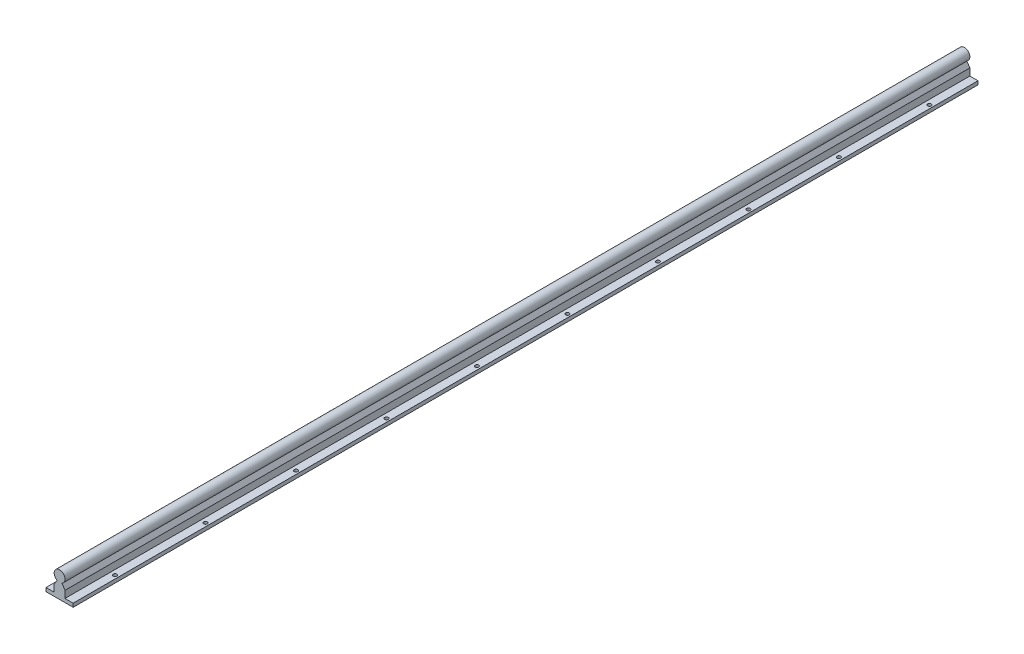
from build123d import *

# Parameters (mm, degrees)
BOSS_EXTRUDE1_DEPTH = 1000
CUT_EXTRUDE1_REACH  = 1002.492
SKETCH2_R           = 2


with BuildPart() as part:
    # Sketch1 → Boss-Extrude1 (new body)
    with BuildSketch(Plane.XY):
        with BuildLine():
            Line((19.707457755, 0), (-10.292542245, 0))
            Line((-10.292542245, 0), (-10.292542245, 4))
            Line((-10.292542245, 4), (-1.292542245, 4))
            Line((-1.292542245, 4), (-1.292542245, 11.8))
            Line((-1.292542245, 11.8), (2.107457755, 17))
            ThreePointArc((2.107457755, 17), (4.707457755, 28.407402334), (7.307457755, 17))
            Line((7.307457755, 17), (10.707457755, 11.8))
            Line((10.707457755, 11.8), (10.707457755, 4))
            Line((10.707457755, 4), (19.707457755, 4))
            Line((19.707457755, 4), (19.707457755, 0))
        make_face()
    extrude(amount=BOSS_EXTRUDE1_DEPTH)

    # Sketch2 → Cut-Extrude1 (cut, up to next)
    with BuildSketch(Plane(origin=(0, 4, 0), x_dir=(1, 0, 0), z_dir=(0, 1, 0)), mode=Mode.PRIVATE) as cut_extrude1_sk1:
        with Locations(Location((-6.542542245, -50, 0), (0, 0, 180))):
            Circle(SKETCH2_R)
    cut_extrude1_tool1 = extrude(cut_extrude1_sk1.sketch, amount=-CUT_EXTRUDE1_REACH, mode=Mode.PRIVATE) & part.part
    # Sketch2 → Cut-Extrude1 (cut, up to next)
    with BuildSketch(Plane(origin=(0, 4, 0), x_dir=(1, 0, 0), z_dir=(0, 1, 0)), mode=Mode.PRIVATE) as cut_extrude1_sk2:
        with Locations(Location((-6.542542245, -150, 0), (0, 0, 180))):
            Circle(SKETCH2_R)
    cut_extrude1_tool2 = extrude(cut_extrude1_sk2.sketch, amount=-CUT_EXTRUDE1_REACH, mode=Mode.PRIVATE) & part.part
    # Sketch2 → Cut-Extrude1 (cut, up to next)
    with BuildSketch(Plane(origin=(0, 4, 0), x_dir=(1, 0, 0), z_dir=(0, 1, 0)), mode=Mode.PRIVATE) as cut_extrude1_sk3:
        with Locations(Location((-6.542542245, -250, 0), (0, 0, 180))):
            Circle(SKETCH2_R)
    cut_extrude1_tool3 = extrude(cut_extrude1_sk3.sketch, amount=-CUT_EXTRUDE1_REACH, mode=Mode.PRIVATE) & part.part
    # Sketch2 → Cut-Extrude1 (cut, up to next)
    with BuildSketch(Plane(origin=(0, 4, 0), x_dir=(1, 0, 0), z_dir=(0, 1, 0)), mode=Mode.PRIVATE) as cut_extrude1_sk4:
        with Locations(Location((-6.542542245, -350, 0), (0, 0, 180))):
            Circle(SKETCH2_R)
    cut_extrude1_tool4 = extrude(cut_extrude1_sk4.sketch, amount=-CUT_EXTRUDE1_REACH, mode=Mode.PRIVATE) & part.part
    # Sketch2 → Cut-Extrude1 (cut, up to next)
    with BuildSketch(Plane(origin=(0, 4, 0), x_dir=(1, 0, 0), z_dir=(0, 1, 0)), mode=Mode.PRIVATE) as cut_extrude1_sk5:
        with Locations(Location((-6.542542245, -450, 0), (0, 0, 180))):
            Circle(SKETCH2_R)
    cut_extrude1_tool5 = extrude(cut_extrude1_sk5.sketch, amount=-CUT_EXTRUDE1_REACH, mode=Mode.PRIVATE) & part.part
    # Sketch2 → Cut-Extrude1 (cut, up to next)
    with BuildSketch(Plane(origin=(0, 4, 0), x_dir=(1, 0, 0), z_dir=(0, 1, 0)), mode=Mode.PRIVATE) as cut_extrude1_sk6:
        with Locations(Location((-6.542542245, -550, 0), (0, 0, 180))):
            Circle(SKETCH2_R)
    cut_extrude1_tool6 = extrude(cut_extrude1_sk6.sketch, amount=-CUT_EXTRUDE1_REACH, mode=Mode.PRIVATE) & part.part
    # Sketch2 → Cut-Extrude1 (cut, up to next)
    with BuildSketch(Plane(origin=(0, 4, 0), x_dir=(1, 0, 0), z_dir=(0, 1, 0)), mode=Mode.PRIVATE) as cut_extrude1_sk7:
        with Locations(Location((-6.542542245, -650, 0), (0, 0, 180))):
            Circle(SKETCH2_R)
    cut_extrude1_tool7 = extrude(cut_extrude1_sk7.sketch, amount=-CUT_EXTRUDE1_REACH, mode=Mode.PRIVATE) & part.part
    # Sketch2 → Cut-Extrude1 (cut, up to next)
    with BuildSketch(Plane(origin=(0, 4, 0), x_dir=(1, 0, 0), z_dir=(0, 1, 0)), mode=Mode.PRIVATE) as cut_extrude1_sk8:
        with Locations(Location((-6.542542245, -750, 0), (0, 0, 180))):
            Circle(SKETCH2_R)
    cut_extrude1_tool8 = extrude(cut_extrude1_sk8.sketch, amount=-CUT_EXTRUDE1_REACH, mode=Mode.PRIVATE) & part.part
    # Sketch2 → Cut-Extrude1 (cut, up to next)
    with BuildSketch(Plane(origin=(0, 4, 0), x_dir=(1, 0, 0), z_dir=(0, 1, 0)), mode=Mode.PRIVATE) as cut_extrude1_sk9:
        with Locations(Location((-6.542542245, -850, 0), (0, 0, 180))):
            Circle(SKETCH2_R)
    cut_extrude1_tool9 = extrude(cut_extrude1_sk9.sketch, amount=-CUT_EXTRUDE1_REACH, mode=Mode.PRIVATE) & part.part
    # Sketch2 → Cut-Extrude1 (cut, up to next)
    with BuildSketch(Plane(origin=(0, 4, 0), x_dir=(1, 0, 0), z_dir=(0, 1, 0)), mode=Mode.PRIVATE) as cut_extrude1_sk10:
        with Locations(Location((-6.542542245, -950, 0), (0, 0, 180))):
            Circle(SKETCH2_R)
    cut_extrude1_tool10 = extrude(cut_extrude1_sk10.sketch, amount=-CUT_EXTRUDE1_REACH, mode=Mode.PRIVATE) & part.part
    # Sketch2 → Cut-Extrude1 (cut, up to next)
    with BuildSketch(Plane(origin=(0, 4, 0), x_dir=(1, 0, 0), z_dir=(0, 1, 0)), mode=Mode.PRIVATE) as cut_extrude1_sk11:
        with Locations(Location((15.957457755, -50, 0), (0, 0, 180))):
            Circle(SKETCH2_R)
    cut_extrude1_tool11 = extrude(cut_extrude1_sk11.sketch, amount=-CUT_EXTRUDE1_REACH, mode=Mode.PRIVATE) & part.part
    # Sketch2 → Cut-Extrude1 (cut, up to next)
    with BuildSketch(Plane(origin=(0, 4, 0), x_dir=(1, 0, 0), z_dir=(0, 1, 0)), mode=Mode.PRIVATE) as cut_extrude1_sk12:
        with Locations(Location((15.957457755, -150, 0), (0, 0, 180))):
            Circle(SKETCH2_R)
    cut_extrude1_tool12 = extrude(cut_extrude1_sk12.sketch, amount=-CUT_EXTRUDE1_REACH, mode=Mode.PRIVATE) & part.part
    # Sketch2 → Cut-Extrude1 (cut, up to next)
    with BuildSketch(Plane(origin=(0, 4, 0), x_dir=(1, 0, 0), z_dir=(0, 1, 0)), mode=Mode.PRIVATE) as cut_extrude1_sk13:
        with Locations(Location((15.957457755, -250, 0), (0, 0, 180))):
            Circle(SKETCH2_R)
    cut_extrude1_tool13 = extrude(cut_extrude1_sk13.sketch, amount=-CUT_EXTRUDE1_REACH, mode=Mode.PRIVATE) & part.part
    # Sketch2 → Cut-Extrude1 (cut, up to next)
    with BuildSketch(Plane(origin=(0, 4, 0), x_dir=(1, 0, 0), z_dir=(0, 1, 0)), mode=Mode.PRIVATE) as cut_extrude1_sk14:
        with Locations(Location((15.957457755, -350, 0), (0, 0, 180))):
            Circle(SKETCH2_R)
    cut_extrude1_tool14 = extrude(cut_extrude1_sk14.sketch, amount=-CUT_EXTRUDE1_REACH, mode=Mode.PRIVATE) & part.part
    # Sketch2 → Cut-Extrude1 (cut, up to next)
    with BuildSketch(Plane(origin=(0, 4, 0), x_dir=(1, 0, 0), z_dir=(0, 1, 0)), mode=Mode.PRIVATE) as cut_extrude1_sk15:
        with Locations(Location((15.957457755, -450, 0), (0, 0, 180))):
            Circle(SKETCH2_R)
    cut_extrude1_tool15 = extrude(cut_extrude1_sk15.sketch, amount=-CUT_EXTRUDE1_REACH, mode=Mode.PRIVATE) & part.part
    # Sketch2 → Cut-Extrude1 (cut, up to next)
    with BuildSketch(Plane(origin=(0, 4, 0), x_dir=(1, 0, 0), z_dir=(0, 1, 0)), mode=Mode.PRIVATE) as cut_extrude1_sk16:
        with Locations(Location((15.957457755, -550, 0), (0, 0, 180))):
            Circle(SKETCH2_R)
    cut_extrude1_tool16 = extrude(cut_extrude1_sk16.sketch, amount=-CUT_EXTRUDE1_REACH, mode=Mode.PRIVATE) & part.part
    # Sketch2 → Cut-Extrude1 (cut, up to next)
    with BuildSketch(Plane(origin=(0, 4, 0), x_dir=(1, 0, 0), z_dir=(0, 1, 0)), mode=Mode.PRIVATE) as cut_extrude1_sk17:
        with Locations(Location((15.957457755, -650, 0), (0, 0, 180))):
            Circle(SKETCH2_R)
    cut_extrude1_tool17 = extrude(cut_extrude1_sk17.sketch, amount=-CUT_EXTRUDE1_REACH, mode=Mode.PRIVATE) & part.part
    # Sketch2 → Cut-Extrude1 (cut, up to next)
    with BuildSketch(Plane(origin=(0, 4, 0), x_dir=(1, 0, 0), z_dir=(0, 1, 0)), mode=Mode.PRIVATE) as cut_extrude1_sk18:
        with Locations(Location((15.957457755, -750, 0), (0, 0, 180))):
            Circle(SKETCH2_R)
    cut_extrude1_tool18 = extrude(cut_extrude1_sk18.sketch, amount=-CUT_EXTRUDE1_REACH, mode=Mode.PRIVATE) & part.part
    # Sketch2 → Cut-Extrude1 (cut, up to next)
    with BuildSketch(Plane(origin=(0, 4, 0), x_dir=(1, 0, 0), z_dir=(0, 1, 0)), mode=Mode.PRIVATE) as cut_extrude1_sk19:
        with Locations(Location((15.957457755, -850, 0), (0, 0, 180))):
            Circle(SKETCH2_R)
    cut_extrude1_tool19 = extrude(cut_extrude1_sk19.sketch, amount=-CUT_EXTRUDE1_REACH, mode=Mode.PRIVATE) & part.part
    # Sketch2 → Cut-Extrude1 (cut, up to next)
    with BuildSketch(Plane(origin=(0, 4, 0), x_dir=(1, 0, 0), z_dir=(0, 1, 0)), mode=Mode.PRIVATE) as cut_extrude1_sk20:
        with Locations(Location((15.957457755, -950, 0), (0, 0, 180))):
            Circle(SKETCH2_R)
    cut_extrude1_tool20 = extrude(cut_extrude1_sk20.sketch, amount=-CUT_EXTRUDE1_REACH, mode=Mode.PRIVATE) & part.part
    add(cut_extrude1_tool1.solids().sort_by_distance((-6.542542, 4, 50))[0], mode=Mode.SUBTRACT)
    add(cut_extrude1_tool2.solids().sort_by_distance((-6.542542, 4, 150))[0], mode=Mode.SUBTRACT)
    add(cut_extrude1_tool3.solids().sort_by_distance((-6.542542, 4, 250))[0], mode=Mode.SUBTRACT)
    add(cut_extrude1_tool4.solids().sort_by_distance((-6.542542, 4, 350))[0], mode=Mode.SUBTRACT)
    add(cut_extrude1_tool5.solids().sort_by_distance((-6.542542, 4, 450))[0], mode=Mode.SUBTRACT)
    add(cut_extrude1_tool6.solids().sort_by_distance((-6.542542, 4, 550))[0], mode=Mode.SUBTRACT)
    add(cut_extrude1_tool7.solids().sort_by_distance((-6.542542, 4, 650))[0], mode=Mode.SUBTRACT)
    add(cut_extrude1_tool8.solids().sort_by_distance((-6.542542, 4, 750))[0], mode=Mode.SUBTRACT)
    add(cut_extrude1_tool9.solids().sort_by_distance((-6.542542, 4, 850))[0], mode=Mode.SUBTRACT)
    add(cut_extrude1_tool10.solids().sort_by_distance((-6.542542, 4, 950))[0], mode=Mode.SUBTRACT)
    add(cut_extrude1_tool11.solids().sort_by_distance((15.957458, 4, 50))[0], mode=Mode.SUBTRACT)
    add(cut_extrude1_tool12.solids().sort_by_distance((15.957458, 4, 150))[0], mode=Mode.SUBTRACT)
    add(cut_extrude1_tool13.solids().sort_by_distance((15.957458, 4, 250))[0], mode=Mode.SUBTRACT)
    add(cut_extrude1_tool14.solids().sort_by_distance((15.957458, 4, 350))[0], mode=Mode.SUBTRACT)
    add(cut_extrude1_tool15.solids().sort_by_distance((15.957458, 4, 450))[0], mode=Mode.SUBTRACT)
    add(cut_extrude1_tool16.solids().sort_by_distance((15.957458, 4, 550))[0], mode=Mode.SUBTRACT)
    add(cut_extrude1_tool17.solids().sort_by_distance((15.957458, 4, 650))[0], mode=Mode.SUBTRACT)
    add(cut_extrude1_tool18.solids().sort_by_distance((15.957458, 4, 750))[0], mode=Mode.SUBTRACT)
    add(cut_extrude1_tool19.solids().sort_by_distance((15.957458, 4, 850))[0], mode=Mode.SUBTRACT)
    add(cut_extrude1_tool20.solids().sort_by_distance((15.957458, 4, 950))[0], mode=Mode.SUBTRACT)


solid = part.part
